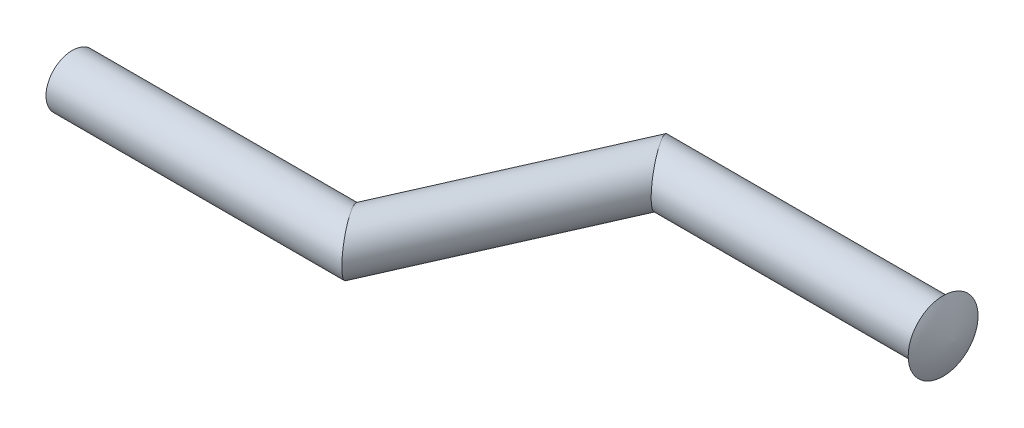
from build123d import *

# Parameters (mm, degrees)
SKETCH3_R = 8.89


with BuildPart() as part:
    # Sweep1: sweep along a path in Sketch1
    with BuildLine(Plane(origin=(0, 0, 0), x_dir=(1, 0, 0), z_dir=(0, 1, 0))) as sweep1_path:
        Line((0, 0), (-95.984915269, 0))
        Line((-95.984915269, 0), (-128.252610358, -72.746173646))
        Line((-128.252610358, -72.746173646), (-222.882267399, -72.746173646))
    # Sketch3 → Sweep1 (sweep)
    with BuildSketch(Plane(origin=(0, 0, 0), x_dir=(0, 0, -1), z_dir=(1, 0, 0))):
        Circle(SKETCH3_R)
    sweep(path=sweep1_path.line, transition=Transition.RIGHT)

    # Sketch6 → Revolve1 (revolve)
    with BuildSketch(Plane(origin=(0, 0, 0), x_dir=(1, 0, 0), z_dir=(0, 1, 0))):
        with BuildLine():
            Line((0, 0), (0, 11.860460566))
            ThreePointArc((0, 11.860460566), (2.307736562, 6.103805999), (3.406950908, 0))
            Line((3.406950908, 0), (0, 0))
        make_face()
    revolve(axis=Axis((0, 0, 0), (1, 0, 0)))


solid = part.part
